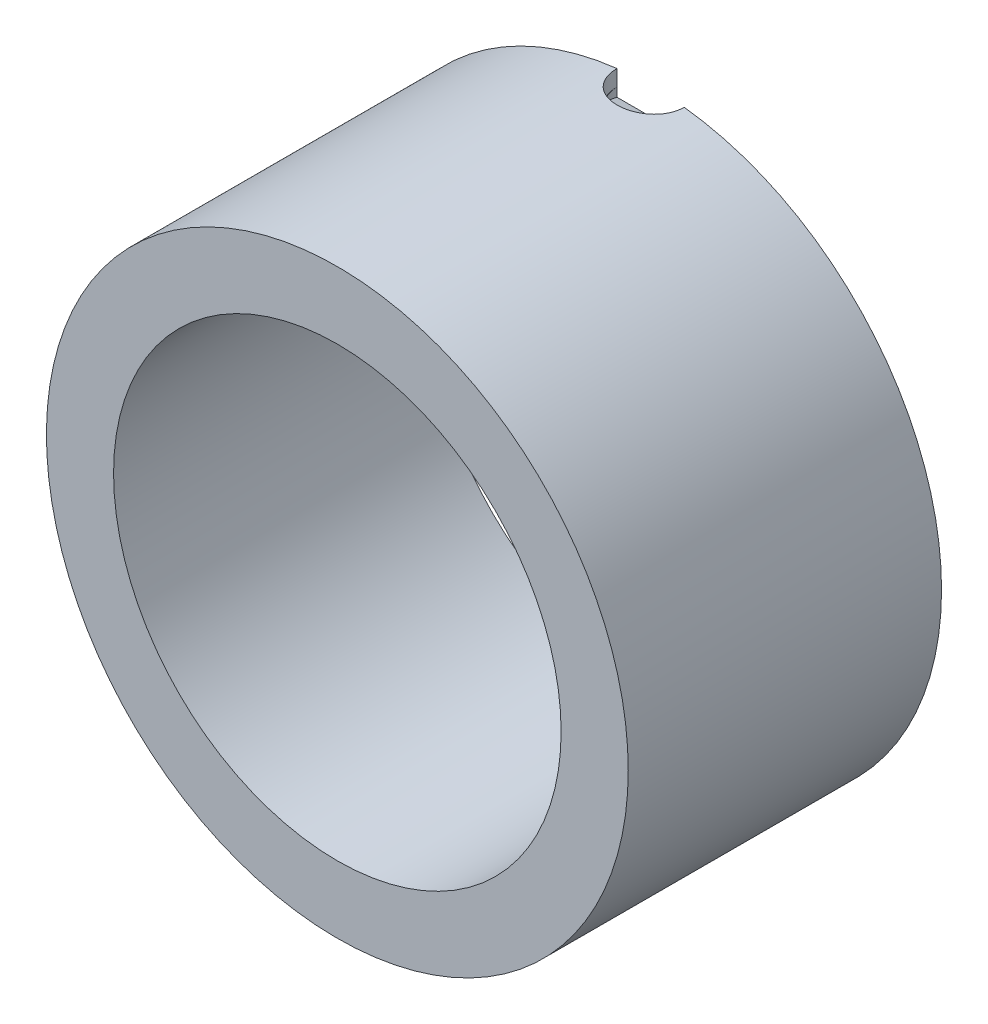
from build123d import *

# Parameters (mm, degrees)
SKETCH_1_R          = 260
SKETCH_1_R_2        = 200
EXTRUDE_1_DEPTH     = 280
SKETCH_4_R          = 30
CUT_EXTRUDE_1_DEPTH = 15.98
SKETCH_18_R         = 30
CUT_EXTRUDE_4_DEPTH = 15.98


with BuildPart() as part:
    # 草图1 → 凸台-拉伸1 (new body)
    with BuildSketch(Plane.XY):
        Circle(SKETCH_1_R)
        Circle(SKETCH_1_R_2, mode=Mode.SUBTRACT)
    extrude(amount=EXTRUDE_1_DEPTH)

    # 草图4 → 切除-拉伸1 (cut)
    with BuildSketch(Plane(origin=(0, 260, 0), x_dir=(1, 0, 0), z_dir=(0, 1, 0))):
        Circle(SKETCH_4_R)
    extrude(amount=-CUT_EXTRUDE_1_DEPTH, mode=Mode.SUBTRACT)

    # 草图18 → 切除-拉伸4 (cut)
    with BuildSketch(Plane(origin=(0, 220.173759516, -58.995381057), x_dir=(-1, 0, 0), z_dir=(0, 0.9659258262890681, -0.25881904510252135))):
        with Locations((0, 62.134798175)):
            Circle(SKETCH_18_R)
    extrude(amount=CUT_EXTRUDE_4_DEPTH, mode=Mode.SUBTRACT)


solid = part.part
